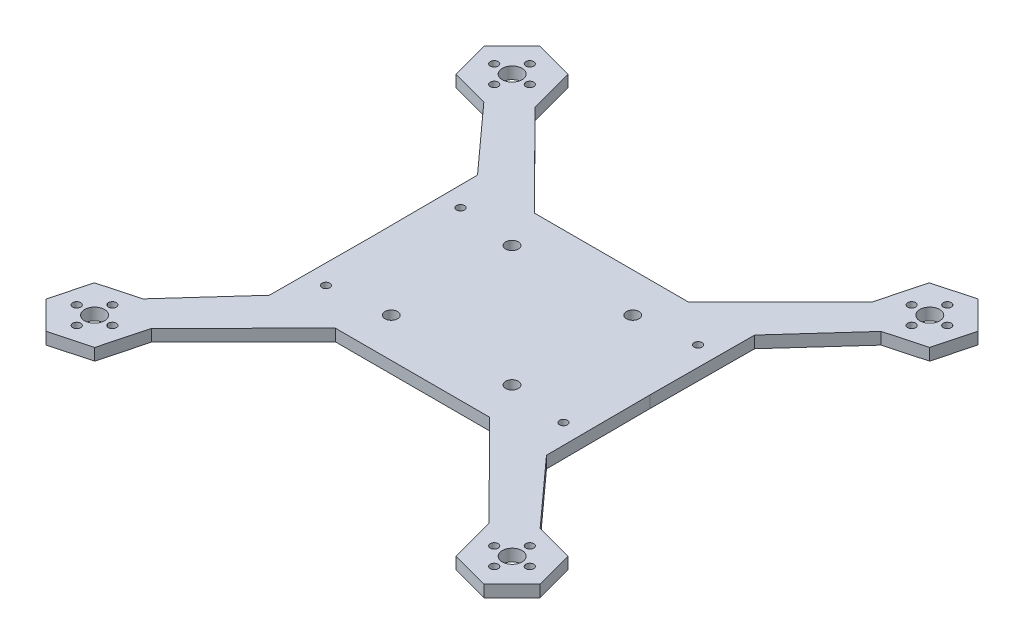
from build123d import *

# Parameters (mm, degrees)
SKETCH1_R           = 1
SKETCH1_R_2         = 1.6
BOSS_EXTRUDE1_DEPTH = 3
SKETCH7_R           = 0.75
BOSS_EXTRUDE4_DEPTH = 0.05
SKETCH8_R           = 2.5
CUT_EXTRUDE7_DEPTH  = 10


with BuildPart() as part:
    # Sketch1 → Boss-Extrude1 (new body)
    with BuildSketch(Plane(origin=(0, 0, 0), x_dir=(1, 0, 0), z_dir=(0, 1, 0))):
        Polygon((43.076410298, 50.123925917), (42.618597625, 48.402115535), (19.4637773, 25.158118275), (-19.4637773, 25.158118275), (-42.618597625, 48.402115535), (-45.64603124, 59.788140743), (-55.300297258, 62.394891143), (-62.384942335, 55.337426715), (-59.815321393, 45.673211889), (-50.185022628, 43.072932893), (-35, 26.288270568), (-34.873, 0), (-35, -26.288270568), (-50.185022628, -43.072932893), (-59.815321393, -45.673211889), (-62.384942335, -55.337426715), (-55.300297258, -62.394891143), (-45.64603124, -59.788140743), (-42.618597625, -48.402115535), (-19.4637773, -25.158118275), (19.4637773, -25.158118275), (42.618597625, -48.402115535), (45.64603124, -59.788140743), (55.300297258, -62.394891143), (62.384942335, -55.337426715), (59.815321393, -45.673211889), (50.185022628, -43.072932893), (35, -26.288270568), (34.873, 0), (35, 26.288270568), (50.185022628, 43.072932893), (59.815321393, 45.673211889), (62.384942335, 55.337426715), (55.300297258, 62.394891143), (45.64603124, 59.788140743), align=None)
        with Locations(Location((-52.730676316, -57.230676316, 0), (0, 0, 270))):
            Circle(SKETCH1_R, mode=Mode.SUBTRACT)
        with Locations(Location((-57.230676316, -52.730676316, 0), (0, 0, 270))):
            Circle(SKETCH1_R, mode=Mode.SUBTRACT)
        with Locations(Location((-48.230676316, -52.730676316, 0), (0, 0, 270))):
            Circle(SKETCH1_R, mode=Mode.SUBTRACT)
        with Locations(Location((-52.730676316, -48.230676316, 0), (0, 0, 270))):
            Circle(SKETCH1_R, mode=Mode.SUBTRACT)
        with Locations(Location((-30, -17, 0), (0, 0, 270))):
            Circle(SKETCH1_R, mode=Mode.SUBTRACT)
        with Locations(Location((-15.25, -15.25, 0), (0, 0, 270))):
            Circle(SKETCH1_R_2, mode=Mode.SUBTRACT)
        with Locations(Location((52.730676316, -57.230676316, 0), (0, 0, 270))):
            Circle(SKETCH1_R, mode=Mode.SUBTRACT)
        with Locations(Location((48.230676316, -52.730676316, 0), (0, 0, 270))):
            Circle(SKETCH1_R, mode=Mode.SUBTRACT)
        with Locations(Location((52.730676316, -48.230676316, 0), (0, 0, 270))):
            Circle(SKETCH1_R, mode=Mode.SUBTRACT)
        with Locations(Location((57.230676316, -52.730676316, 0), (0, 0, 270))):
            Circle(SKETCH1_R, mode=Mode.SUBTRACT)
        with Locations(Location((30, -17, 0), (0, 0, 270))):
            Circle(SKETCH1_R, mode=Mode.SUBTRACT)
        with Locations(Location((15.25, -15.25, 0), (0, 0, 270))):
            Circle(SKETCH1_R_2, mode=Mode.SUBTRACT)
        with Locations(Location((-15.25, 15.25, 0), (0, 0, 270))):
            Circle(SKETCH1_R_2, mode=Mode.SUBTRACT)
        with Locations(Location((-30, 17, 0), (0, 0, 270))):
            Circle(SKETCH1_R, mode=Mode.SUBTRACT)
        with Locations(Location((-57.230676316, 52.730676316, 0), (0, 0, 270))):
            Circle(SKETCH1_R, mode=Mode.SUBTRACT)
        with Locations(Location((-52.730676316, 48.230676316, 0), (0, 0, 270))):
            Circle(SKETCH1_R, mode=Mode.SUBTRACT)
        with Locations(Location((-48.230676316, 52.730676316, 0), (0, 0, 270))):
            Circle(SKETCH1_R, mode=Mode.SUBTRACT)
        with Locations(Location((-52.730676316, 57.230676316, 0), (0, 0, 270))):
            Circle(SKETCH1_R, mode=Mode.SUBTRACT)
        with Locations(Location((15.25, 15.25, 0), (0, 0, 270))):
            Circle(SKETCH1_R_2, mode=Mode.SUBTRACT)
        with Locations(Location((30, 17, 0), (0, 0, 270))):
            Circle(SKETCH1_R, mode=Mode.SUBTRACT)
        with Locations(Location((52.730676316, 48.230676316, 0), (0, 0, 270))):
            Circle(SKETCH1_R, mode=Mode.SUBTRACT)
        with Locations(Location((48.230676316, 52.730676316, 0), (0, 0, 270))):
            Circle(SKETCH1_R, mode=Mode.SUBTRACT)
        with Locations(Location((57.230676316, 52.730676316, 0), (0, 0, 270))):
            Circle(SKETCH1_R, mode=Mode.SUBTRACT)
        with Locations(Location((52.730676316, 57.230676316, 0), (0, 0, 270))):
            Circle(SKETCH1_R, mode=Mode.SUBTRACT)
    extrude(amount=BOSS_EXTRUDE1_DEPTH)

    # Sketch7 → Boss-Extrude4 (add)
    with BuildSketch(Plane(origin=(0, 3, 0), x_dir=(1, 0, 0), z_dir=(0, 1, 0))):
        with Locations(Location((-52.730676316, -52.730676316, 0), (0, 0, 270))):
            Circle(SKETCH7_R)
        with Locations(Location((-52.730676316, 52.730676316, 0), (0, 0, 90))):
            Circle(SKETCH7_R)
        with Locations(Location((52.730676316, 52.730676316, 0), (0, 0, 270))):
            Circle(SKETCH7_R)
        with Locations(Location((52.730676316, -52.730676316, 0), (0, 0, 90))):
            Circle(SKETCH7_R)
    extrude(amount=BOSS_EXTRUDE4_DEPTH)

    # Sketch8 → Cut-Extrude7 (cut)
    with BuildSketch(Plane(origin=(0, 3, 0), x_dir=(1, 0, 0), z_dir=(0, 1, 0))):
        with Locations(Location((-52.730676316, -52.730676316, 0), (0, 0, 270))):
            Circle(SKETCH8_R)
        with Locations(Location((52.769323684, -52.730676316, 0), (0, 0, 270))):
            Circle(SKETCH8_R)
        with Locations(Location((52.769323684, 52.769323684, 0), (0, 0, 270))):
            Circle(SKETCH8_R)
        with Locations(Location((-52.730676316, 52.769323684, 0), (0, 0, 270))):
            Circle(SKETCH8_R)
    extrude(amount=-CUT_EXTRUDE7_DEPTH, mode=Mode.SUBTRACT)


with BuildPart() as body_2:
    # of the pieces the cut leaves, the one that is kept (cut_extrude7_keep)
    add(part.part.solids().sort_by_distance((-19.4637773, 0, 25.158118275))[0])


solid = body_2.part
